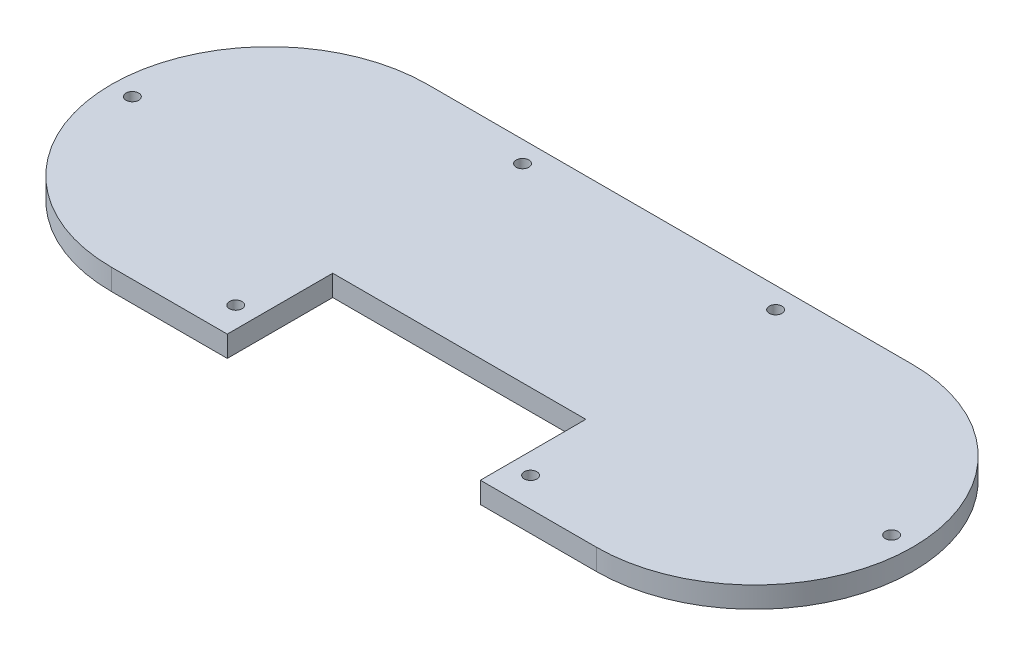
from build123d import *

# Parameters (mm, degrees)
SKETCH1_R           = 1.5
BOSS_EXTRUDE1_DEPTH = 5


with BuildPart() as part:
    # Sketch1 → Boss-Extrude1 (new body)
    with BuildSketch(Plane(origin=(0, 0, 0), x_dir=(1, 0, 0), z_dir=(0, 1, 0))):
        with BuildLine():
            Line((-57.5, 37.5), (57.5, 37.5))
            ThreePointArc((57.5, 37.5), (95, 0), (57.5, -37.5))
            Line((57.5, -37.5), (30, -37.5))
            Line((30, -37.5), (30, -12.5))
            Line((30, -12.5), (-30, -12.5))
            Line((-30, -12.5), (-30, -37.5))
            Line((-30, -37.5), (-57.5, -37.5))
            ThreePointArc((-57.5, -37.5), (-95, 0), (-57.5, 37.5))
        make_face()
        with Locations(Location((-90, 0, 0), (0, 0, 270))):
            Circle(SKETCH1_R, mode=Mode.SUBTRACT)
        with Locations(Location((-30, 32.5, 0), (0, 0, 270))):
            Circle(SKETCH1_R, mode=Mode.SUBTRACT)
        with Locations(Location((30, 32.5, 0), (0, 0, 270))):
            Circle(SKETCH1_R, mode=Mode.SUBTRACT)
        with Locations(Location((90, 0, 0), (0, 0, 270))):
            Circle(SKETCH1_R, mode=Mode.SUBTRACT)
        with Locations(Location((34.949747468, -30.550252532, 0), (0, 0, 270))):
            Circle(SKETCH1_R, mode=Mode.SUBTRACT)
        with Locations(Location((-34.949747468, -30.550252532, 0), (0, 0, 270))):
            Circle(SKETCH1_R, mode=Mode.SUBTRACT)
    extrude(amount=BOSS_EXTRUDE1_DEPTH)


solid = part.part
